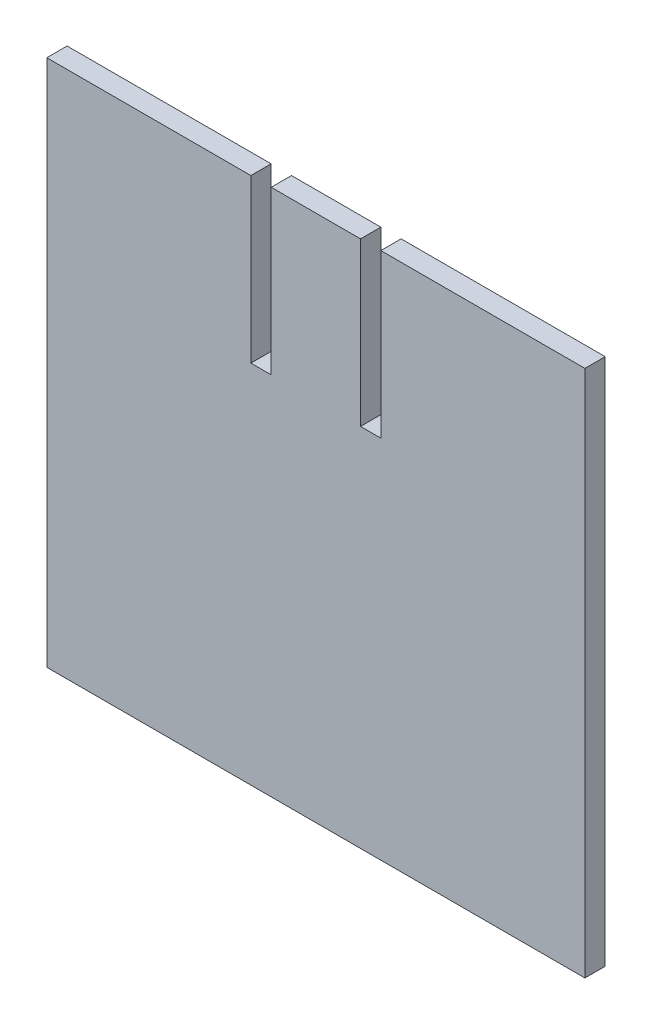
from build123d import *

# Parameters (mm, degrees)
BOSS_EXTRUDE1_DEPTH = 6.35


with BuildPart() as part:
    # Sketch1 → Boss-Extrude1 (new body)
    with BuildSketch(Plane.XY):
        Polygon((63.8175, 165.1), (0, 165.1), (0, 0), (168.275, 0), (168.275, 165.1), (104.4575, 165.1), (104.4575, 114.3), (98.1075, 114.3), (98.1075, 165.1), (70.1675, 165.1), (70.1675, 114.3), (63.8175, 114.3), align=None)
    extrude(amount=BOSS_EXTRUDE1_DEPTH)


solid = part.part
